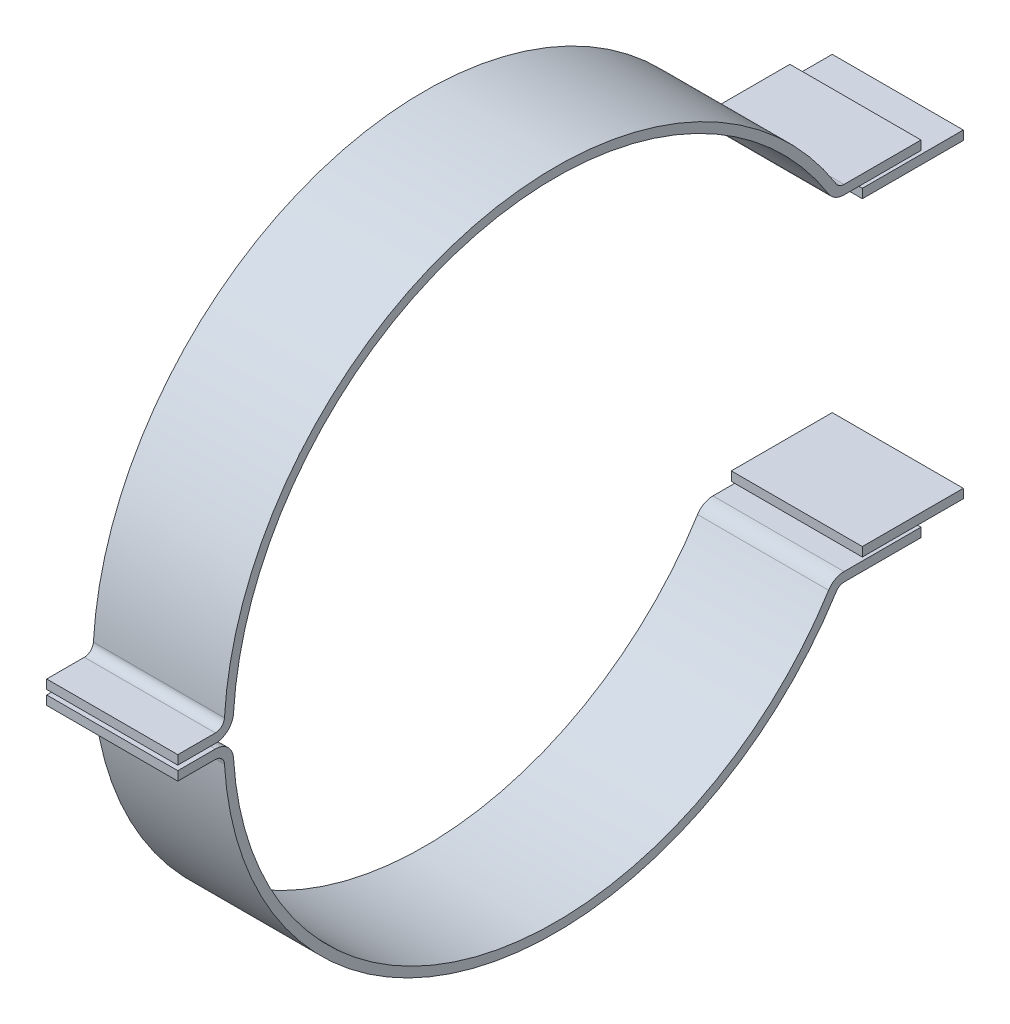
from build123d import *

# Parameters (mm, degrees)
BOSS_EXTRUDE1_DEPTH   = 144
BOSS_EXTRUDE1_2_DEPTH = 144
SKETCH1_W             = 110.88159645
SKETCH1_H             = 10
BOSS_EXTRUDE1_3_DEPTH = 144
BOSS_EXTRUDE1_4_DEPTH = 144


with BuildPart() as part:
    # Sketch1 → Boss-Extrude1 (new body)
    with BuildSketch(Plane(origin=(0, 0, 0), x_dir=(0, 0, -1), z_dir=(1, 0, 0))):
        with BuildLine():
            Line((122.399148509, -74.980712069), (122.399148509, -64.980712069))
            Line((122.399148509, -64.980712069), (37.886897495, -64.980712069))
            ThreePointArc((37.886897495, -64.980712069), (28.212497607, -67.47625587), (20.952386586, -74.340113388))
            ThreePointArc((20.952386586, -74.340113388), (-366.866488635, -229.129821907), (-632.812876508, 92.795406397))
            ThreePointArc((-632.812876508, 92.795406397), (-639.06784691, 106.150638768), (-652.776386049, 111.587810928))
            Line((-652.776386049, 111.587810928), (-694.05780786, 111.587810928))
            Line((-694.05780786, 111.587810928), (-694.05780786, 101.587810928))
            Line((-694.05780786, 101.587810928), (-652.776386049, 101.587810928))
            ThreePointArc((-652.776386049, 101.587810928), (-645.92211648, 98.869224848), (-642.794631279, 92.191608663))
            ThreePointArc((-642.794631279, 92.191608663), (-369.343336207, -238.818228696), (29.41964204, -79.660412728))
            ThreePointArc((29.41964204, -79.660412728), (33.049697551, -76.228483969), (37.886897495, -74.980712069))
            Line((37.886897495, -74.980712069), (122.399148509, -74.980712069))
        make_face()
    extrude(amount=BOSS_EXTRUDE1_DEPTH)


with BuildPart() as body_2:
    # Sketch1 → Boss-Extrude1 2 (new body)
    with BuildSketch(Plane(origin=(0, 0, 0), x_dir=(0, 0, -1), z_dir=(1, 0, 0))):
        with BuildLine():
            Line((-652.776386049, 116.795756587), (-694.05780786, 116.795756587))
            Line((-694.05780786, 116.795756587), (-694.05780786, 126.795756587))
            Line((-694.05780786, 126.795756587), (-652.776386049, 126.795756587))
            ThreePointArc((-652.776386049, 126.795756587), (-645.92211648, 129.514342667), (-642.794631279, 136.191958853))
            ThreePointArc((-642.794631279, 136.191958853), (-369.343336207, 467.201796212), (29.41964204, 308.043980244))
            ThreePointArc((29.41964204, 308.043980244), (33.049697551, 304.612051485), (37.886897495, 303.364279585))
            Line((37.886897495, 303.364279585), (122.399148509, 303.364279585))
            Line((122.399148509, 303.364279585), (122.399148509, 293.364279585))
            Line((122.399148509, 293.364279585), (37.886897495, 293.364279585))
            ThreePointArc((37.886897495, 293.364279585), (28.212497607, 295.859823386), (20.952386586, 302.723680904))
            ThreePointArc((20.952386586, 302.723680904), (-366.866488635, 457.513389423), (-632.812876508, 135.588161118))
            ThreePointArc((-632.812876508, 135.588161118), (-639.06784691, 122.232928748), (-652.776386049, 116.795756587))
        make_face()
    extrude(amount=BOSS_EXTRUDE1_2_DEPTH)


with BuildPart() as body_3:
    # Sketch1 → Boss-Extrude1 3 (new body)
    with BuildSketch(Plane(origin=(0, 0, 0), x_dir=(0, 0, -1), z_dir=(1, 0, 0))):
        with Locations((113.436775578, -56.245173975)):
            Rectangle(SKETCH1_W, SKETCH1_H)
    extrude(amount=BOSS_EXTRUDE1_3_DEPTH)


with BuildPart() as body_4:
    # Sketch1 → Boss-Extrude1 4 (new body)
    with BuildSketch(Plane(origin=(0, 0, 0), x_dir=(0, 0, -1), z_dir=(1, 0, 0))):
        with Locations((113.436775578, 284.62874149)):
            Rectangle(SKETCH1_W, SKETCH1_H)
    extrude(amount=BOSS_EXTRUDE1_4_DEPTH)


solid = Compound([part.part, body_2.part, body_3.part, body_4.part])
